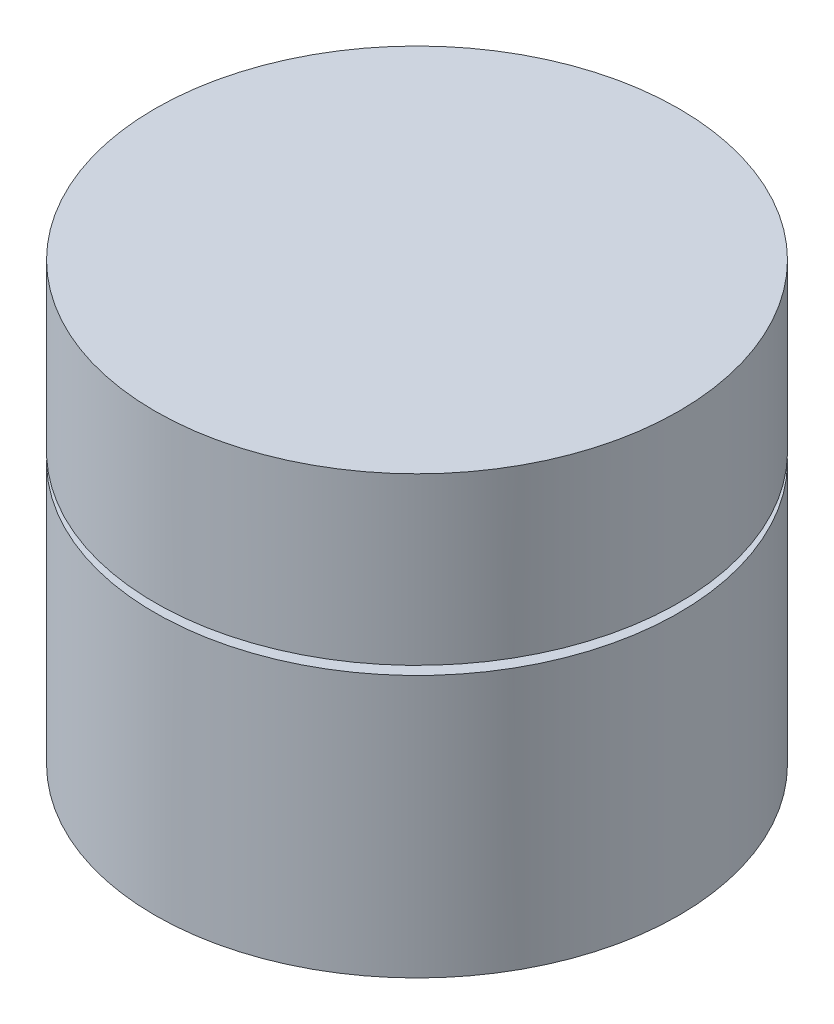
from build123d import *

# Parameters (mm, degrees)
SKETCH1_R           = 3
BOSS_EXTRUDE1_DEPTH = 5
SKETCH2_W           = 0.25
SKETCH2_H           = 0.1


with BuildPart() as part:
    # Sketch1 → Boss-Extrude1 (new body)
    with BuildSketch(Plane(origin=(0, 0, 0), x_dir=(1, 0, 0), z_dir=(0, 1, 0))):
        with Locations(Location((0, 0, 0), (0, 0, 270))):
            Circle(SKETCH1_R)
    extrude(amount=BOSS_EXTRUDE1_DEPTH)

    # Sketch2 → Cut-Revolve1 (revolve, cut)
    with BuildSketch(Plane.XY, mode=Mode.PRIVATE) as cut_revolve1_sk:
        with Locations((2.875, 3.05)):
            Rectangle(SKETCH2_W, SKETCH2_H)
    revolve(cut_revolve1_sk.sketch.rotate(Axis((0, 0, 0), (0, 1, 0)), 90), axis=Axis((0, 0, 0), (0, 1, 0)), mode=Mode.SUBTRACT)


solid = part.part
